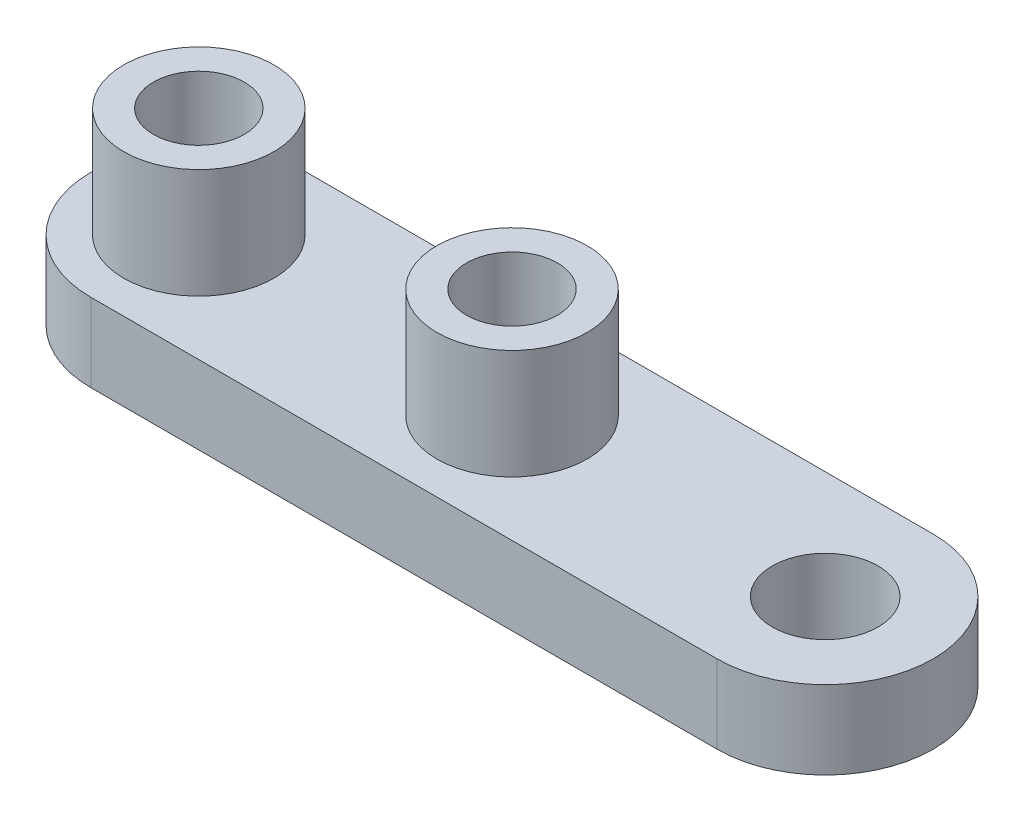
from build123d import *

# Parameters (mm, degrees)
CROQUIS2_R              = 1.45
SALIENTE_EXTRUIR1_DEPTH = 2.5
CROQUIS3_R              = 2.4
CROQUIS3_R_2            = 1.45
SALIENTE_EXTRUIR2_DEPTH = 3.5
CROQUIS4_R              = 1.69
CORTAR_EXTRUIR1_DEPTH   = 24.959444902


with BuildPart() as part:
    # Croquis2 → Saliente-Extruir1 (new body)
    with BuildSketch(Plane(origin=(0, 0, 0), x_dir=(1, 0, 0), z_dir=(0, 1, 0))):
        with BuildLine():
            Line((0, 3.45), (20, 3.45))
            ThreePointArc((20, 3.45), (23.45, 0), (20, -3.45))
            Line((20, -3.45), (0, -3.45))
            ThreePointArc((0, -3.45), (-3.45, 0), (0, 3.45))
        make_face()
        with Locations(Location((0, 0, 0), (0, 0, 270))):
            Circle(CROQUIS2_R, mode=Mode.SUBTRACT)
        with Locations(Location((10, 0, 0), (0, 0, 270))):
            Circle(CROQUIS2_R, mode=Mode.SUBTRACT)
    extrude(amount=SALIENTE_EXTRUIR1_DEPTH)

    # Croquis3 → Saliente-Extruir2 (add)
    # profile 1 of 2: a face of its own
    with BuildSketch(Plane(origin=(0, 2.5, 0), x_dir=(1, 0, 0), z_dir=(0, 1, 0))):
        with Locations(Location((0, 0, 0), (0, 0, 270))):
            Circle(CROQUIS3_R)
        with Locations(Location((0, 0, 0), (0, 0, 270))):
            Circle(CROQUIS3_R_2, mode=Mode.SUBTRACT)
    # profile 2 of 2: a face of its own
    with BuildSketch(Plane(origin=(0, 2.5, 0), x_dir=(1, 0, 0), z_dir=(0, 1, 0))):
        with Locations(Location((10, 0, 0), (0, 0, 270))):
            Circle(CROQUIS3_R)
        with Locations(Location((10, 0, 0), (0, 0, 270))):
            Circle(CROQUIS3_R_2, mode=Mode.SUBTRACT)
    extrude(amount=SALIENTE_EXTRUIR2_DEPTH)

    # Croquis4 → Cortar-Extruir1 (cut, through all)
    with BuildSketch(Plane(origin=(0, 2.5, 0), x_dir=(1, 0, 0), z_dir=(0, 1, 0))):
        with Locations(Location((20, 0, 0), (0, 0, 270))):
            Circle(CROQUIS4_R)
    extrude(amount=-CORTAR_EXTRUIR1_DEPTH, mode=Mode.SUBTRACT)


solid = part.part
